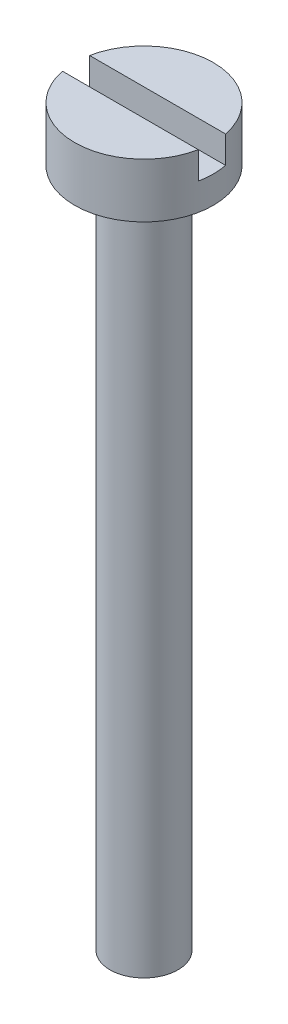
from build123d import *

# Parameters (mm, degrees)
SKETCH1_R           = 2.55
BOSS_EXTRUDE1_DEPTH = 2
SKETCH2_R           = 1.25
BOSS_EXTRUDE2_DEPTH = 25
SKETCH3_W           = 6
SKETCH3_H           = 1
CUT_EXTRUDE1_DEPTH  = 1


with BuildPart() as part:
    # Sketch1 → Boss-Extrude1 (new body)
    with BuildSketch(Plane(origin=(0, 0, 0), x_dir=(1, 0, 0), z_dir=(0, 1, 0))):
        with Locations(Location((0, 0, 0), (0, 0, 270))):
            Circle(SKETCH1_R)
    extrude(amount=BOSS_EXTRUDE1_DEPTH)

    # Sketch2 → Boss-Extrude2 (add)
    with BuildSketch(Plane(origin=(0, 0, 0), x_dir=(1, 0, 0), z_dir=(0, 1, 0))):
        with Locations(Location((0, 0, 0), (0, 0, 270))):
            Circle(SKETCH2_R)
    extrude(amount=-BOSS_EXTRUDE2_DEPTH)

    # Sketch3 → Cut-Extrude1 (cut)
    with BuildSketch(Plane(origin=(0, 2, 0), x_dir=(1, 0, 0), z_dir=(0, 1, 0))):
        Rectangle(SKETCH3_W, SKETCH3_H)
    extrude(amount=-CUT_EXTRUDE1_DEPTH, mode=Mode.SUBTRACT)


solid = part.part
